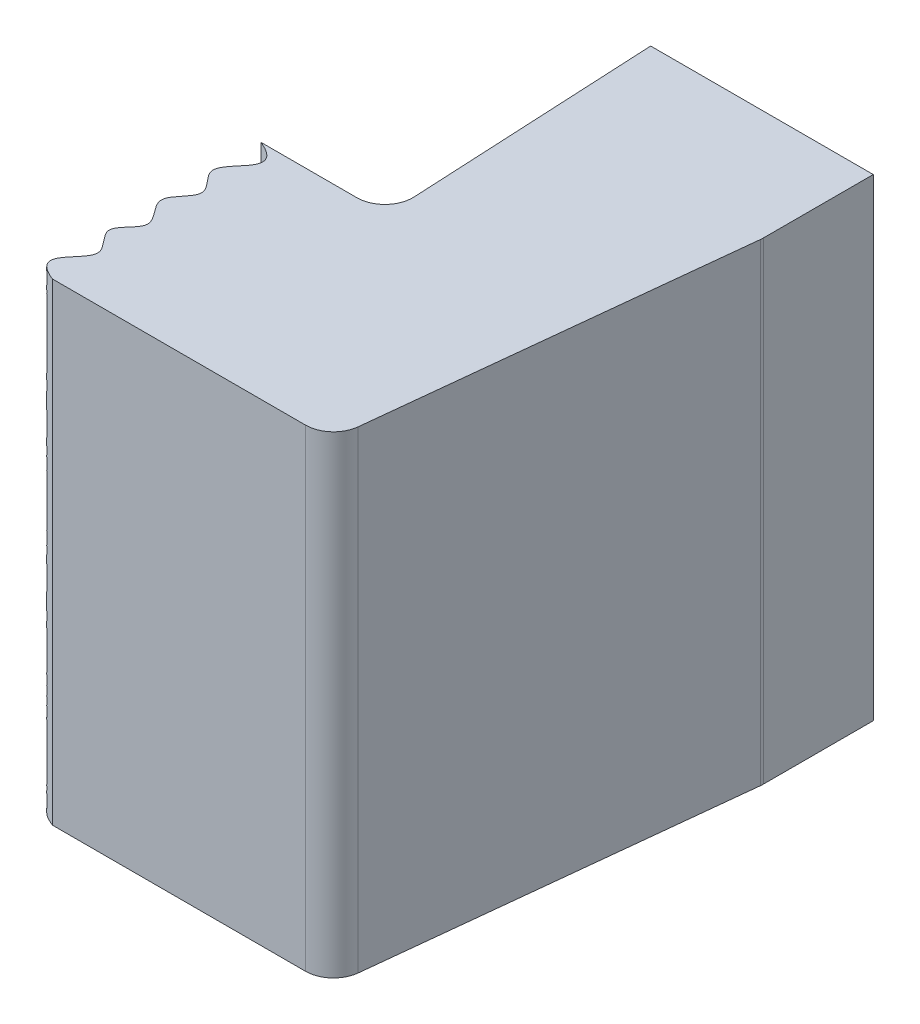
from build123d import *

# Parameters (mm, degrees)
BOSS_EXTRUDE1_DEPTH = 17
FILLET1_R           = 1


with BuildPart() as part:
    # Sketch1 → Boss-Extrude1 (new body)
    with BuildSketch(Plane(origin=(0, 0, 0), x_dir=(1, 0, 0), z_dir=(0, 1, 0))):
        with BuildLine():
            Line((0, 0), (8, 0))
            Line((8, 0), (8, -4))
            Line((8, -4), (6.5, -18))
            Line((6.5, -18), (-3.5, -18))
            add(Edge.make_bspline(
                [(-4, -10), (-2.520129607, -10.606471076), (-4.866391531, -11.474049713), (-3.032257304, -12.646210324), (-4.527780587, -13.584230575), (-2.991690416, -14.577055865), (-4.460661732, -15.446588285), (-2.638934103, -16.607403934), (-4.908064967, -17.438401471), (-3.5, -18)],
                knots=[0, 0, 0, 0, 0.221861931, 0.329573952, 0.444854002, 0.572311823, 0.676833042, 0.787768673, 1, 1, 1, 1], degree=3))
            Line((-4, -10), (-3.5, -10))
            Line((-3.5, -10), (0.5, -10))
            Line((0.5, -10), (0, 0))
        make_face()
    extrude(amount=BOSS_EXTRUDE1_DEPTH)

    # Fillet1
    fillet1_edges = [part.edges().sort_by_distance(p)[0] for p in [
        (8, 8.5, 4),
        (6.5, 8.5, 18),
        (0.5, 8.5, 10),
    ]]
    fillet(fillet1_edges, radius=FILLET1_R)


solid = part.part
